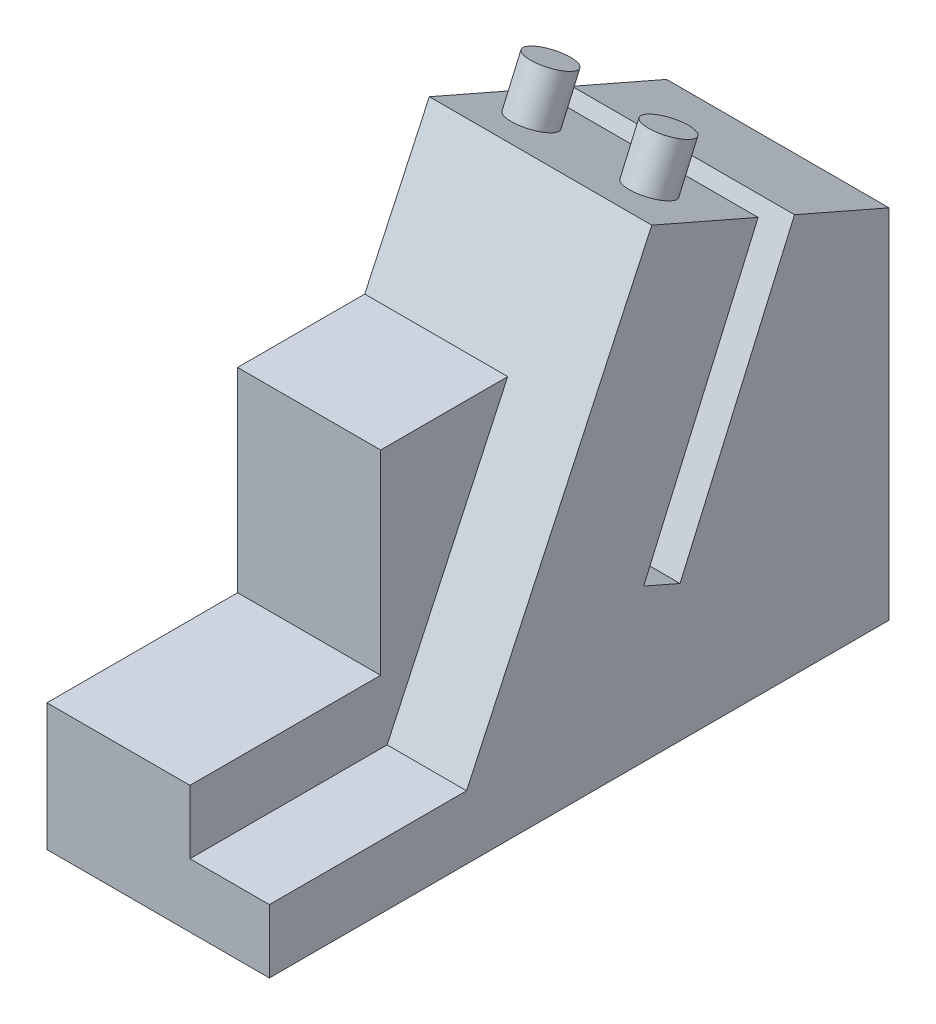
from build123d import *

# Parameters (mm, degrees)
SKETCH1_W           = 28
SKETCH1_H           = 78
BOSS_EXTRUDE1_DEPTH = 58
CUT_EXTRUDE1_DEPTH  = 10
CUT_EXTRUDE2_DEPTH  = 20
CUT_EXTRUDE3_DEPTH  = 30
SKETCH5_R           = 2.75
BOSS_EXTRUDE2_DEPTH = 6


with BuildPart() as part:
    # Sketch1 → Boss-Extrude1 (new body)
    with BuildSketch(Plane(origin=(0, 0, 0), x_dir=(1, 0, 0), z_dir=(0, 1, 0))):
        Rectangle(SKETCH1_W, SKETCH1_H)
    extrude(amount=BOSS_EXTRUDE1_DEPTH)

    # Sketch2 → Cut-Extrude1 (cut)
    with BuildSketch(Plane(origin=(14, 0, 0), x_dir=(0, 0, -1), z_dir=(1, 0, 0))):
        Polygon((-39, 8), (-14.181832949, 8), (9.133549959, 58), (-39, 58), align=None)
    extrude(amount=-CUT_EXTRUDE1_DEPTH, mode=Mode.SUBTRACT)

    # Sketch3 → Cut-Extrude2 (cut)
    with BuildSketch(Plane(origin=(4, 0, 0), x_dir=(0, 0, -1), z_dir=(1, 0, 0))):
        Polygon((-39, 16), (-15, 16), (-15, 40.557545824), (1, 40.557545824), (9.133549959, 58), (-39, 58), align=None)
    extrude(amount=-CUT_EXTRUDE2_DEPTH, mode=Mode.SUBTRACT)

    # Sketch4 → Cut-Extrude3 (cut)
    with BuildSketch(Plane(origin=(14, 0, 0), x_dir=(0, 0, -1), z_dir=(1, 0, 0))):
        Polygon((9.133549959, 58), (22.517676281, 52.154545261), (8.109098298, 19.163745323), (12.691153845, 17.162553937), (27.099731828, 50.153353874), (39, 44.95596726), (39, 58), align=None)
    extrude(amount=-CUT_EXTRUDE3_DEPTH, mode=Mode.SUBTRACT)

    # Sketch5 → Boss-Extrude2 (add)
    with BuildSketch(Plane(origin=(0, 52.058969702, -22.736512182), x_dir=(1, 0, 0), z_dir=(0, 0.9164111093707628, -0.40023827730721606))):
        with Locations(Location((-8.021015767, -7.343733433, 0), (0, 0, 90))):
            Circle(SKETCH5_R)
        with Locations(Location((6.818441056, -7.343733433, 0), (0, 0, 90))):
            Circle(SKETCH5_R)
    extrude(amount=BOSS_EXTRUDE2_DEPTH)


solid = part.part
